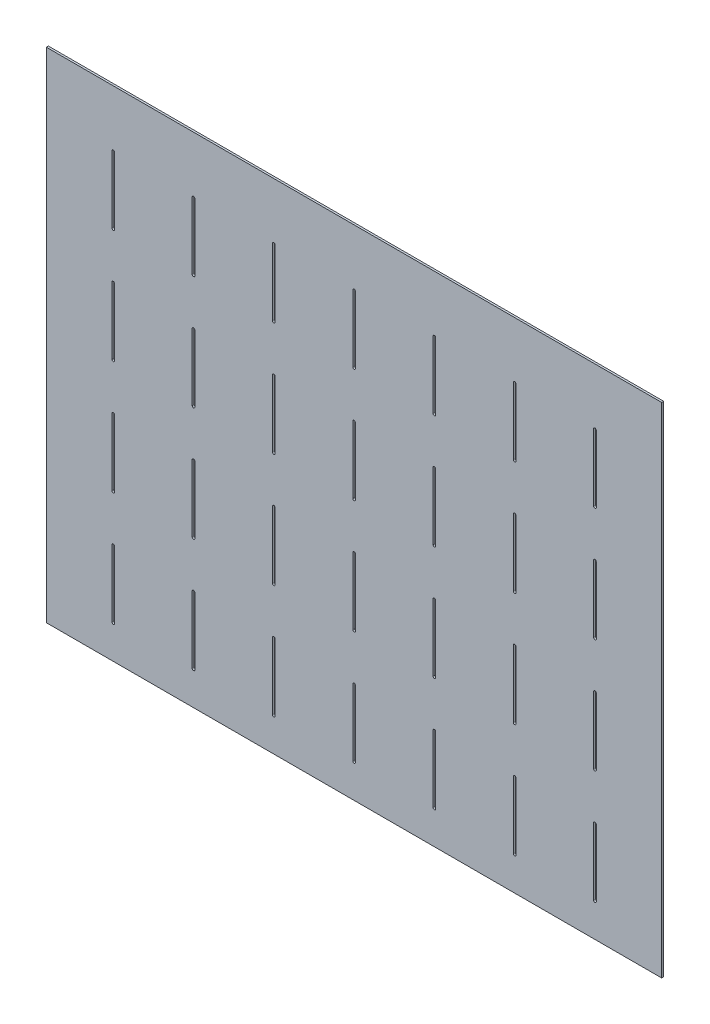
from build123d import *

# Parameters (mm, degrees)
SKETCH_1_W          = 919.725090766
SKETCH_1_H          = 745
EXTRUDE_1_DEPTH     = 3
CUT_EXTRUDE_1_DEPTH = 3


with BuildPart() as part:
    # Эскиз1 → Бобышка-Вытянуть1 (new body)
    with BuildSketch(Plane.XY):
        with Locations((419.862545383, 369.5)):
            Rectangle(SKETCH_1_W, SKETCH_1_H)
    extrude(amount=EXTRUDE_1_DEPTH)

    # Эскиз3 → Вырез-Вытянуть1 (cut)
    with BuildSketch(Plane(origin=(0, 0, 0), x_dir=(-1, 0, 0), z_dir=(0, 0, -1))):
        with BuildLine():
            Line((-62, 47), (-62, 147))
            ThreePointArc((-62, 147), (-60, 149), (-58, 147))
            Line((-58, 147), (-58, 47))
            ThreePointArc((-58, 47), (-60, 45), (-62, 47))
        make_face()
        with BuildLine():
            Line((-182, 47), (-182, 147))
            ThreePointArc((-182, 147), (-180, 149), (-178, 147))
            Line((-178, 147), (-178, 47))
            ThreePointArc((-178, 47), (-180, 45), (-182, 47))
        make_face()
        with BuildLine():
            Line((-302, 47), (-302, 147))
            ThreePointArc((-302, 147), (-300, 149), (-298, 147))
            Line((-298, 147), (-298, 47))
            ThreePointArc((-298, 47), (-300, 45), (-302, 47))
        make_face()
        with BuildLine():
            Line((-422, 47), (-422, 147))
            ThreePointArc((-422, 147), (-420, 149), (-418, 147))
            Line((-418, 147), (-418, 47))
            ThreePointArc((-418, 47), (-420, 45), (-422, 47))
        make_face()
        with BuildLine():
            Line((-542, 47), (-542, 147))
            ThreePointArc((-542, 147), (-540, 149), (-538, 147))
            Line((-538, 147), (-538, 47))
            ThreePointArc((-538, 47), (-540, 45), (-542, 47))
        make_face()
        with BuildLine():
            Line((-662, 47), (-662, 147))
            ThreePointArc((-662, 147), (-660, 149), (-658, 147))
            Line((-658, 147), (-658, 47))
            ThreePointArc((-658, 47), (-660, 45), (-662, 47))
        make_face()
        with BuildLine():
            Line((-782, 47), (-782, 147))
            ThreePointArc((-782, 147), (-780, 149), (-778, 147))
            Line((-778, 147), (-778, 47))
            ThreePointArc((-778, 47), (-780, 45), (-782, 47))
        make_face()
        with BuildLine():
            Line((-182, 217), (-182, 317))
            ThreePointArc((-182, 317), (-180, 319), (-178, 317))
            Line((-178, 317), (-178, 217))
            ThreePointArc((-178, 217), (-180, 215), (-182, 217))
        make_face()
        with BuildLine():
            Line((-302, 217), (-302, 317))
            ThreePointArc((-302, 317), (-300, 319), (-298, 317))
            Line((-298, 317), (-298, 217))
            ThreePointArc((-298, 217), (-300, 215), (-302, 217))
        make_face()
        with BuildLine():
            Line((-422, 217), (-422, 317))
            ThreePointArc((-422, 317), (-420, 319), (-418, 317))
            Line((-418, 317), (-418, 217))
            ThreePointArc((-418, 217), (-420, 215), (-422, 217))
        make_face()
        with BuildLine():
            Line((-542, 217), (-542, 317))
            ThreePointArc((-542, 317), (-540, 319), (-538, 317))
            Line((-538, 317), (-538, 217))
            ThreePointArc((-538, 217), (-540, 215), (-542, 217))
        make_face()
        with BuildLine():
            Line((-662, 217), (-662, 317))
            ThreePointArc((-662, 317), (-660, 319), (-658, 317))
            Line((-658, 317), (-658, 217))
            ThreePointArc((-658, 217), (-660, 215), (-662, 217))
        make_face()
        with BuildLine():
            Line((-782, 217), (-782, 317))
            ThreePointArc((-782, 317), (-780, 319), (-778, 317))
            Line((-778, 317), (-778, 217))
            ThreePointArc((-778, 217), (-780, 215), (-782, 217))
        make_face()
        with BuildLine():
            Line((-182, 387), (-182, 487))
            ThreePointArc((-182, 487), (-180, 489), (-178, 487))
            Line((-178, 487), (-178, 387))
            ThreePointArc((-178, 387), (-180, 385), (-182, 387))
        make_face()
        with BuildLine():
            Line((-302, 387), (-302, 487))
            ThreePointArc((-302, 487), (-300, 489), (-298, 487))
            Line((-298, 487), (-298, 387))
            ThreePointArc((-298, 387), (-300, 385), (-302, 387))
        make_face()
        with BuildLine():
            Line((-422, 387), (-422, 487))
            ThreePointArc((-422, 487), (-420, 489), (-418, 487))
            Line((-418, 487), (-418, 387))
            ThreePointArc((-418, 387), (-420, 385), (-422, 387))
        make_face()
        with BuildLine():
            Line((-542, 387), (-542, 487))
            ThreePointArc((-542, 487), (-540, 489), (-538, 487))
            Line((-538, 487), (-538, 387))
            ThreePointArc((-538, 387), (-540, 385), (-542, 387))
        make_face()
        with BuildLine():
            Line((-662, 387), (-662, 487))
            ThreePointArc((-662, 487), (-660, 489), (-658, 487))
            Line((-658, 487), (-658, 387))
            ThreePointArc((-658, 387), (-660, 385), (-662, 387))
        make_face()
        with BuildLine():
            Line((-782, 387), (-782, 487))
            ThreePointArc((-782, 487), (-780, 489), (-778, 487))
            Line((-778, 487), (-778, 387))
            ThreePointArc((-778, 387), (-780, 385), (-782, 387))
        make_face()
        with BuildLine():
            Line((-182, 557), (-182, 657))
            ThreePointArc((-182, 657), (-180, 659), (-178, 657))
            Line((-178, 657), (-178, 557))
            ThreePointArc((-178, 557), (-180, 555), (-182, 557))
        make_face()
        with BuildLine():
            Line((-302, 557), (-302, 657))
            ThreePointArc((-302, 657), (-300, 659), (-298, 657))
            Line((-298, 657), (-298, 557))
            ThreePointArc((-298, 557), (-300, 555), (-302, 557))
        make_face()
        with BuildLine():
            Line((-422, 557), (-422, 657))
            ThreePointArc((-422, 657), (-420, 659), (-418, 657))
            Line((-418, 657), (-418, 557))
            ThreePointArc((-418, 557), (-420, 555), (-422, 557))
        make_face()
        with BuildLine():
            Line((-542, 557), (-542, 657))
            ThreePointArc((-542, 657), (-540, 659), (-538, 657))
            Line((-538, 657), (-538, 557))
            ThreePointArc((-538, 557), (-540, 555), (-542, 557))
        make_face()
        with BuildLine():
            Line((-662, 557), (-662, 657))
            ThreePointArc((-662, 657), (-660, 659), (-658, 657))
            Line((-658, 657), (-658, 557))
            ThreePointArc((-658, 557), (-660, 555), (-662, 557))
        make_face()
        with BuildLine():
            Line((-782, 557), (-782, 657))
            ThreePointArc((-782, 657), (-780, 659), (-778, 657))
            Line((-778, 657), (-778, 557))
            ThreePointArc((-778, 557), (-780, 555), (-782, 557))
        make_face()
        with BuildLine():
            Line((-62, 217), (-62, 317))
            ThreePointArc((-62, 317), (-60, 319), (-58, 317))
            Line((-58, 317), (-58, 217))
            ThreePointArc((-58, 217), (-60, 215), (-62, 217))
        make_face()
        with BuildLine():
            Line((-62, 387), (-62, 487))
            ThreePointArc((-62, 487), (-60, 489), (-58, 487))
            Line((-58, 487), (-58, 387))
            ThreePointArc((-58, 387), (-60, 385), (-62, 387))
        make_face()
        with BuildLine():
            Line((-62, 557), (-62, 657))
            ThreePointArc((-62, 657), (-60, 659), (-58, 657))
            Line((-58, 657), (-58, 557))
            ThreePointArc((-58, 557), (-60, 555), (-62, 557))
        make_face()
    extrude(amount=-CUT_EXTRUDE_1_DEPTH, mode=Mode.SUBTRACT)


solid = part.part
